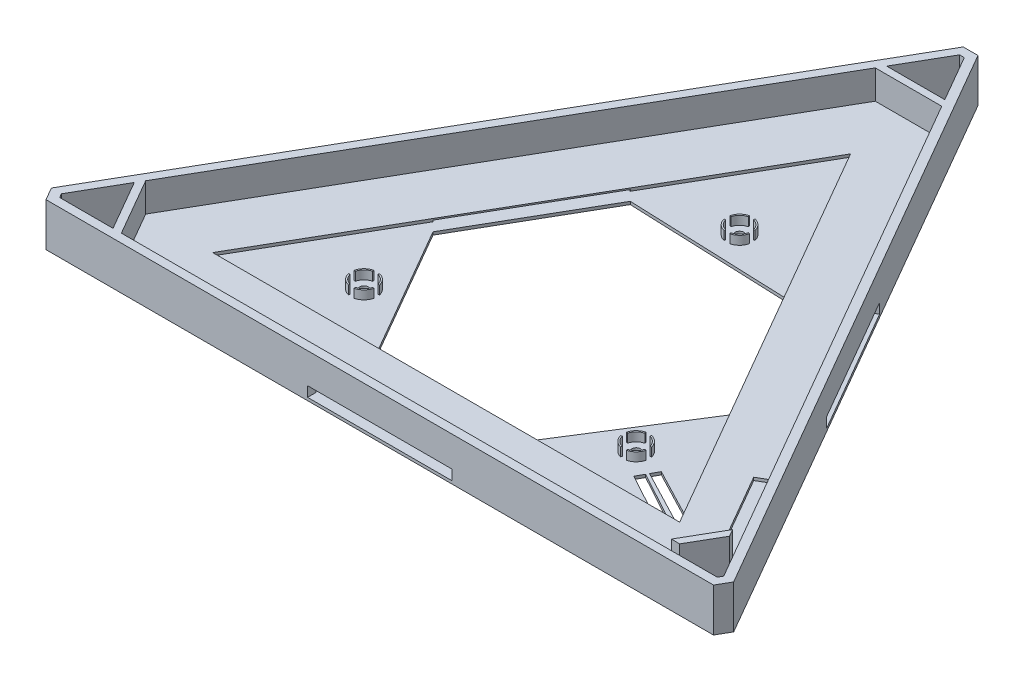
from build123d import *

# Parameters (mm, degrees)
SKETCH1_W                = 34.714871787
SKETCH1_H                = 6
BOSS_EXTRUDE1_DEPTH      = 1
BOSS_EXTRUDE2_DEPTH      = 11
BOSS_EXTRUDE3_DEPTH      = 5
BOSS_EXTRUDE3_DEPTH_BACK = 3
SKETCH3_W                = 50
SKETCH3_H                = 7
CUT_EXTRUDE3_DEPTH       = 25
SKETCH5_W                = 50
SKETCH5_H                = 7
CUT_EXTRUDE4_DEPTH       = 25
SKETCH6_W                = 50
SKETCH6_H                = 7
CUT_EXTRUDE5_DEPTH       = 25
SKETCH8_R                = 1.500000001
SKETCH8_R_2              = 1.499999999
BOSS_EXTRUDE5_DEPTH      = 1
BOSS_EXTRUDE10_DEPTH     = 3


with BuildPart() as part:
    # Sketch1 → Boss-Extrude1 (new body)
    with BuildSketch(Plane(origin=(0, 0, 0), x_dir=(1, 0, 0), z_dir=(0, 1, 0))):
        Polygon((243.304219779, -116.484791863), (254.809280582, -136.408896135), (442.602090749, -136.409305398), (444.621046678, -132.925433226), (441.749040748, -132.925433226), (449.516726723, -119.47140646), (450.9646953, -121.978953126), (452.699916625, -118.984688022), (358.778179038, 43.666038061), (335.767496282, 43.666038061), align=None)
        with Locations((422.370878913, -131.984588005)):
            Rectangle(SKETCH1_W, SKETCH1_H, mode=Mode.SUBTRACT)
        Polygon((450.119365975, -117.364996826), (444.923425166, -120.365363323), (427.455346217, -90.114690822), (432.651287025, -87.114324326), align=None, mode=Mode.SUBTRACT)
        Polygon((428.11367092, -116.417164681), (266.439108269, -116.428009228), (347.27360973, 23.609230811), align=None, mode=Mode.SUBTRACT)
    extrude(amount=BOSS_EXTRUDE1_DEPTH)

    # Sketch1<9> → Boss-Extrude2 (add)
    # profile 1 of 2: a face of its own
    with BuildSketch(Plane(origin=(0, 0, 0), x_dir=(1, 0, 0), z_dir=(0, 1, 0))):
        Polygon((229.15943255, -134.984249185), (231.716666588, -139.412373829), (462.829865412, -139.412373829), (465.38624875, -134.984588004), (349.829542096, 65.165499075), (344.716133219, 65.165499075), align=None)
        Polygon((251.922647993, -136.409305396), (233.446303405, -136.408896135), (232.623553964, -134.984217354), (241.860901693, -118.984688015), align=None, mode=Mode.SUBTRACT)
        Polygon((442.602090749, -136.409305398), (254.809280582, -136.408896135), (243.304219779, -116.484791863), (335.767496282, 43.666038061), (358.778179038, 43.666038061), (461.93896796, -134.98458801), (461.116393748, -136.409305398), align=None, mode=Mode.SUBTRACT)
        Polygon((348.096628302, 62.164013367), (357.334800991, 46.166038067), (337.210874326, 46.166038067), (346.44844193, 62.165948237), align=None, mode=Mode.SUBTRACT)
    # profile 2 of 2: a face of its own
    with BuildSketch(Plane(origin=(0, 0, 0), x_dir=(1, 0, 0), z_dir=(0, 1, 0))):
        Polygon((441.749040748, -132.925433226), (444.621046678, -132.925433226), (450.9646953, -121.978953126), (449.516726723, -119.47140646), align=None)
    extrude(amount=BOSS_EXTRUDE2_DEPTH)

    # Sketch1<10> → Boss-Extrude3 (add, two sides: drawn at the far end of the back side and taken through both)
    # profile 1 of 2: a face of its own
    with BuildSketch(Plane(origin=(0, 0, 0), x_dir=(1, 0, 0), z_dir=(0, 1, 0)).offset(-BOSS_EXTRUDE3_DEPTH_BACK)):
        Polygon((229.15943255, -134.984249185), (231.716666588, -139.412373829), (462.829865412, -139.412373829), (465.38624875, -134.984588004), (349.829542096, 65.165499075), (344.716133219, 65.165499075), align=None)
        Polygon((251.922647993, -136.409305396), (233.446303405, -136.408896135), (232.623553964, -134.984217354), (241.860901693, -118.984688015), align=None, mode=Mode.SUBTRACT)
        Polygon((442.602090749, -136.409305398), (254.809280582, -136.408896135), (243.304219779, -116.484791863), (335.767496282, 43.666038061), (358.778179038, 43.666038061), (461.93896796, -134.98458801), (461.116393748, -136.409305398), align=None, mode=Mode.SUBTRACT)
        Polygon((348.096628302, 62.164013367), (357.334800991, 46.166038067), (337.210874326, 46.166038067), (346.44844193, 62.165948237), align=None, mode=Mode.SUBTRACT)
    # profile 2 of 2: a face of its own
    with BuildSketch(Plane(origin=(0, 0, 0), x_dir=(1, 0, 0), z_dir=(0, 1, 0)).offset(-BOSS_EXTRUDE3_DEPTH_BACK)):
        Polygon((441.749040748, -132.925433226), (444.621046678, -132.925433226), (450.9646953, -121.978953126), (449.516726723, -119.47140646), align=None)
    extrude(amount=BOSS_EXTRUDE3_DEPTH + BOSS_EXTRUDE3_DEPTH_BACK)

    # Sketch3 → Cut-Extrude3 (cut)
    with BuildSketch(Plane(origin=(290.589645397, 0, -167.772009994), x_dir=(-0.49999999999998745, 0, -0.8660254037844459), z_dir=(0.8660254037844459, 0, -0.49999999999998745))):
        with Locations((-236.592990632, -3)):
            Rectangle(SKETCH3_W, SKETCH3_H)
    extrude(amount=-CUT_EXTRUDE3_DEPTH, mode=Mode.SUBTRACT)

    # Sketch5 → Cut-Extrude4 (cut)
    with BuildSketch(Plane.XY.offset(139.412373829)):
        with Locations((347.273266, -3)):
            Rectangle(SKETCH5_W, SKETCH5_H)
    extrude(amount=-CUT_EXTRUDE4_DEPTH, mode=Mode.SUBTRACT)

    # Sketch6 → Cut-Extrude5 (cut)
    with BuildSketch(Plane(origin=(230.319375802, 0, 132.975171836), x_dir=(-0.5000006153901599, 0, 0.8660250484884727), z_dir=(-0.8660250484884727, 0, -0.5000006153901599))):
        with Locations((-113.236674797, -3)):
            Rectangle(SKETCH6_W, SKETCH6_H)
    extrude(amount=-CUT_EXTRUDE5_DEPTH, mode=Mode.SUBTRACT)

    # Sketch8 → Boss-Extrude5 (add)
    with BuildSketch(Plane.XZ.offset(3)):
        Polygon((349.829542096, -65.165499075), (465.38624875, 134.984588004), (462.829865412, 139.412373829), (231.716666588, 139.412373829), (229.15943255, 134.984249185), (344.716133219, -65.165499075), align=None)
        with Locations((395.323540807, 98.692824233)):
            Circle(SKETCH8_R, mode=Mode.SUBTRACT)
        with Locations((348.301285092, 15.86352663)):
            Circle(SKETCH8_R_2, mode=Mode.SUBTRACT)
        with Locations((299.654911442, 97.241681778)):
            Circle(SKETCH8_R, mode=Mode.SUBTRACT)
        Polygon((444.621046678, 132.925433226), (450.9646953, 121.978953126), (449.516726723, 119.47140646), (427.347592194, 115.090208206), (404.332986149, 103.060878104), (405.774939108, 100.430142149), (424.549299543, 110.243170392), (451.871255231, 117.549638152), (452.699916625, 118.984688022), (461.93896796, 134.98458801), (461.116393748, 136.409305398), (442.602090749, 136.409305398), (439.019602541, 136.409297591), (420.379437569, 116.417683466), (402.410382204, 106.568526043), (403.852335163, 103.937790089), (426.620208945, 116.417264858), (441.749040748, 132.925433226), align=None, mode=Mode.SUBTRACT)
        Polygon((322.273266, 116.424264074), (294.35821863, 68.061097963), (319.354499369, 24.757680454), (376.473657314, 26.969372807), (401.472679509, 70.271207532), (372.273266, 116.420910254), align=None, mode=Mode.SUBTRACT)
        Polygon((233.446303405, 136.408896135), (251.922647993, 136.409305396), (241.860901693, 118.984688015), (232.623553964, 134.984217354), align=None, mode=Mode.SUBTRACT)
        Polygon((337.210874326, -46.166038067), (357.334800991, -46.166038067), (348.096628302, -62.164013367), (346.44844193, -62.165948237), align=None, mode=Mode.SUBTRACT)
    extrude(amount=BOSS_EXTRUDE5_DEPTH)

    # Sketch12 → Boss-Extrude10 (add)
    with BuildSketch(Plane(origin=(0, -3, 0), x_dir=(1, 0, 0), z_dir=(0, 1, 0))):
        with BuildLine():
            ThreePointArc((352.690173981, -14.86971864), (351.483265607, -12.681546115), (349.295093082, -11.474637741))
            Line((349.295093082, -11.474637742), (349.184669972, -11.962292063))
            ThreePointArc((349.184669972, -11.962292062), (351.129712217, -13.035099505), (352.20251966, -14.98014175))
            Line((352.20251966, -14.98014175), (352.690173981, -14.86971864))
        make_face()
        with BuildLine():
            Line((347.417900212, -11.962292063), (347.307477102, -11.474637742))
            ThreePointArc((347.307477102, -11.474637741), (345.119304576, -12.681546115), (343.912396203, -14.86971864))
            Line((343.912396203, -14.86971864), (344.400050524, -14.98014175))
            ThreePointArc((344.400050524, -14.98014175), (345.472857967, -13.035099505), (347.417900212, -11.962292062))
        make_face()
        with BuildLine():
            ThreePointArc((349.295093082, -20.25241552), (351.483265607, -19.045507146), (352.690173981, -16.85733462))
            Line((352.690173981, -16.85733462), (352.20251966, -16.74691151))
            ThreePointArc((352.20251966, -16.74691151), (351.129712217, -18.691953755), (349.184669972, -19.764761199))
            Line((349.184669972, -19.764761198), (349.295093082, -20.252415519))
        make_face()
        with BuildLine():
            Line((344.400050524, -16.74691151), (343.912396203, -16.85733462))
            ThreePointArc((343.912396203, -16.85733462), (345.119304576, -19.045507146), (347.307477102, -20.25241552))
            Line((347.307477102, -20.252415519), (347.417900212, -19.764761198))
            ThreePointArc((347.417900212, -19.764761199), (345.472857967, -18.691953755), (344.400050524, -16.74691151))
        make_face()
        with BuildLine():
            Line((394.440155927, -94.791589665), (394.329732817, -94.303935344))
            ThreePointArc((394.329732817, -94.303935343), (392.141560291, -95.510843717), (390.934651917, -97.699016243))
            Line((390.934651918, -97.699016243), (391.424789599, -97.798542944))
            ThreePointArc((391.424789599, -97.798542944), (392.499067688, -95.860448621), (394.440155927, -94.791589664))
        make_face()
        with BuildLine():
            ThreePointArc((399.712429696, -97.699016243), (398.505521322, -95.510843717), (396.317348797, -94.303935343))
            Line((396.317348797, -94.303935344), (396.206925687, -94.791589665))
            ThreePointArc((396.206925687, -94.791589664), (398.151967932, -95.864397108), (399.224775375, -97.809439353))
            Line((399.224775375, -97.809439353), (399.712429695, -97.699016243))
        make_face()
        with BuildLine():
            Line((391.422306239, -99.576209113), (390.934651918, -99.686632223))
            ThreePointArc((390.934651917, -99.686632223), (392.141560291, -101.874804748), (394.329732817, -103.081713122))
            Line((394.329732817, -103.081713121), (394.440155927, -102.5940588))
            ThreePointArc((394.440155927, -102.594058801), (392.495113682, -101.521251358), (391.422306238, -99.576209113))
        make_face()
        with BuildLine():
            ThreePointArc((396.317348797, -103.081713122), (398.505521322, -101.874804748), (399.712429696, -99.686632223))
            Line((399.712429695, -99.686632223), (399.224775375, -99.576209113))
            ThreePointArc((399.224775375, -99.576209113), (398.151967932, -101.521251358), (396.206925687, -102.594058801))
            Line((396.206925687, -102.5940588), (396.317348797, -103.081713121))
        make_face()
        with BuildLine():
            ThreePointArc((298.661103452, -92.85279289), (296.472930928, -94.059701263), (295.266022554, -96.247873788))
            Line((295.266022553, -96.247873788), (295.753676874, -96.358296898))
            ThreePointArc((295.753676875, -96.358296898), (296.826484318, -94.413254654), (298.771526562, -93.340447211))
            Line((298.771526562, -93.34044721), (298.661103452, -92.852792889))
        make_face()
        with BuildLine():
            Line((295.753676874, -98.125066658), (295.266022553, -98.235489768))
            ThreePointArc((295.266022554, -98.235489767), (296.472930928, -100.423662292), (298.661103452, -101.630570665))
            Line((298.661103452, -101.630570666), (298.771526562, -101.142916345))
            ThreePointArc((298.771526562, -101.142916344), (296.826484318, -100.070108901), (295.753676875, -98.125066657))
        make_face()
        with BuildLine():
            ThreePointArc((304.04380033, -96.247873788), (302.836891957, -94.059701263), (300.648719432, -92.85279289))
            Line((300.648719432, -92.852792889), (300.538296322, -93.34044721))
            ThreePointArc((300.538296322, -93.340447211), (302.483338566, -94.413254654), (303.556146009, -96.358296898))
            Line((303.55614601, -96.358296898), (304.043800331, -96.247873788))
        make_face()
        with BuildLine():
            Line((300.538296322, -101.142916345), (300.648719432, -101.630570666))
            ThreePointArc((300.648719432, -101.630570665), (302.836891957, -100.423662292), (304.04380033, -98.235489767))
            Line((304.043800331, -98.235489768), (303.55614601, -98.125066658))
            ThreePointArc((303.556146009, -98.125066657), (302.483338566, -100.070108901), (300.538296322, -101.142916344))
        make_face()
    extrude(amount=BOSS_EXTRUDE10_DEPTH)


solid = part.part
